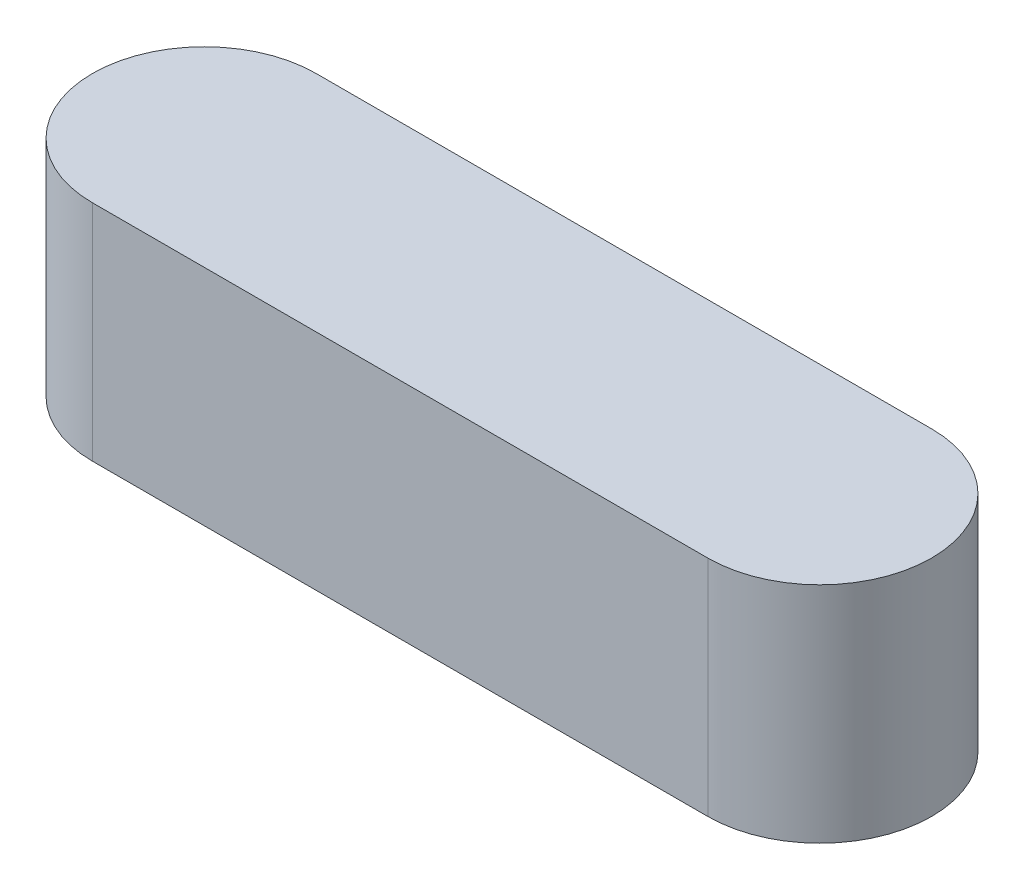
from build123d import *

# Parameters (mm, degrees)
BOSS_EXTRUDE1_DEPTH = 20


with BuildPart() as part:
    # Sketch1 → Boss-Extrude1 (new body)
    with BuildSketch(Plane(origin=(0, 0, 0), x_dir=(1, 0, 0), z_dir=(0, 1, 0))):
        with BuildLine():
            Line((-27.5, 10), (27.5, 10))
            ThreePointArc((27.5, 10), (37.5, 0), (27.5, -10))
            Line((27.5, -10), (-27.5, -10))
            ThreePointArc((-27.5, -10), (-37.5, 0), (-27.5, 10))
        make_face()
    extrude(amount=BOSS_EXTRUDE1_DEPTH)


solid = part.part
